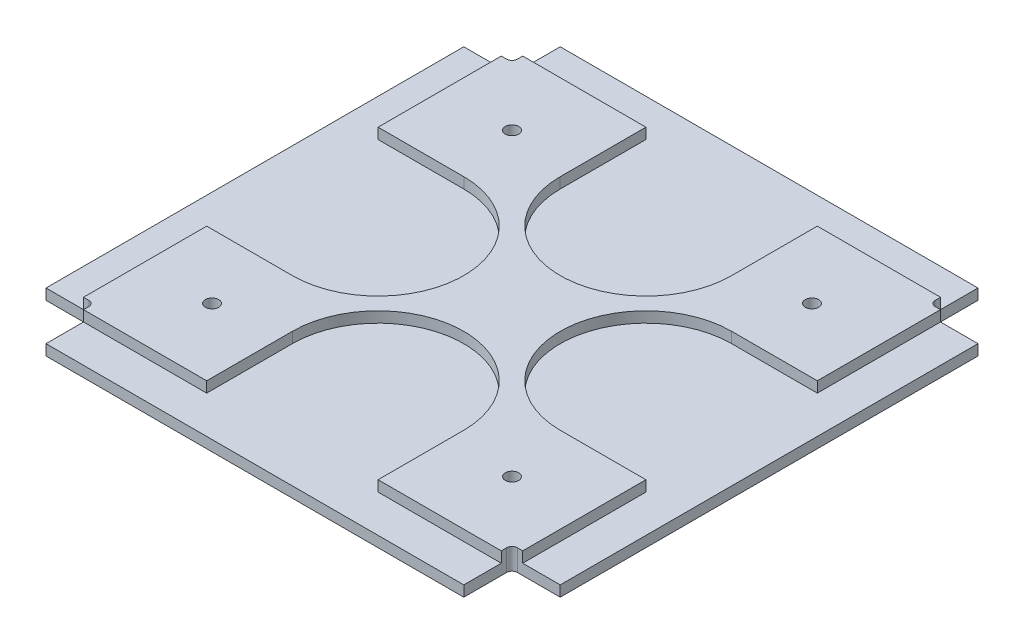
from build123d import *

# Parameters (mm, degrees)
BASE_DEPTH                         = 2
ANTENNA_STORAGE_DEPTH              = 2
M3X0_5_TAPPED_HOLES_FOR_MOUNTING_D = 2.5


with BuildPart() as part:
    # Sketch1 → Base (new body)
    with BuildSketch(Plane(origin=(0, 0, 0), x_dir=(1, 0, 0), z_dir=(0, 1, 0))):
        with BuildLine():
            Line((0, 9), (8, 9))
            ThreePointArc((8, 9), (8.707106781, 8.707106781), (9, 8))
            Line((9, 8), (9, 0))
            Line((9, 0), (87, 0))
            Line((87, 0), (87, 8))
            ThreePointArc((87, 8), (87.292893219, 8.707106781), (88, 9))
            Line((88, 9), (96, 9))
            Line((96, 9), (96, 87))
            Line((96, 87), (88, 87))
            ThreePointArc((88, 87), (87.292893219, 87.292893219), (87, 88))
            Line((87, 88), (87, 96))
            Line((87, 96), (9, 96))
            Line((9, 96), (9, 88))
            ThreePointArc((9, 88), (8.707106781, 87.292893219), (8, 87))
            Line((8, 87), (0, 87))
            Line((0, 87), (0, 9))
        make_face()
    extrude(amount=BASE_DEPTH)

    # Sketch2 → Antenna Storage (add)
    with BuildSketch(Plane(origin=(0, 2, 0), x_dir=(1, 0, 0), z_dir=(0, 1, 0))):
        with BuildLine():
            Line((32, 89), (32, 73))
            ThreePointArc((32, 73), (48, 57), (64, 73))
            Line((64, 73), (64, 89))
            Line((64, 89), (87, 89))
            Line((87, 89), (87, 88))
            ThreePointArc((87, 88), (87.292893219, 87.292893219), (88, 87))
            Line((88, 87), (89, 87))
            Line((89, 87), (89, 64))
            Line((89, 64), (73, 64))
            ThreePointArc((73, 64), (57, 48), (73, 32))
            Line((73, 32), (89, 32))
            Line((89, 32), (89, 9))
            Line((89, 9), (88, 9))
            ThreePointArc((88, 9), (87.292893219, 8.707106781), (87, 8))
            Line((87, 8), (87, 7))
            Line((87, 7), (64, 7))
            Line((64, 7), (64, 23))
            ThreePointArc((64, 23), (48, 39), (32, 23))
            Line((32, 23), (32, 7))
            Line((32, 7), (9, 7))
            Line((9, 7), (9, 8))
            ThreePointArc((9, 8), (8.707106781, 8.707106781), (8, 9))
            Line((8, 9), (7, 9))
            Line((7, 9), (7, 32))
            Line((7, 32), (23, 32))
            ThreePointArc((23, 32), (39, 48), (23, 64))
            Line((23, 64), (7, 64))
            Line((7, 64), (7, 87))
            Line((7, 87), (8, 87))
            ThreePointArc((8, 87), (8.707106781, 87.292893219), (9, 88))
            Line((9, 88), (9, 89))
            Line((9, 89), (32, 89))
        make_face()
    extrude(amount=ANTENNA_STORAGE_DEPTH)

    # M3x0.5 Tapped Holes For Mounting (through all)
    with Locations(Plane(origin=(0, 4, 0), x_dir=(-1, 0, 0), z_dir=(0, 1, 0))):
        with Locations((-20, -20), (-20, -76), (-76, -20), (-76, -76)):
            Hole(M3X0_5_TAPPED_HOLES_FOR_MOUNTING_D / 2)


solid = part.part
